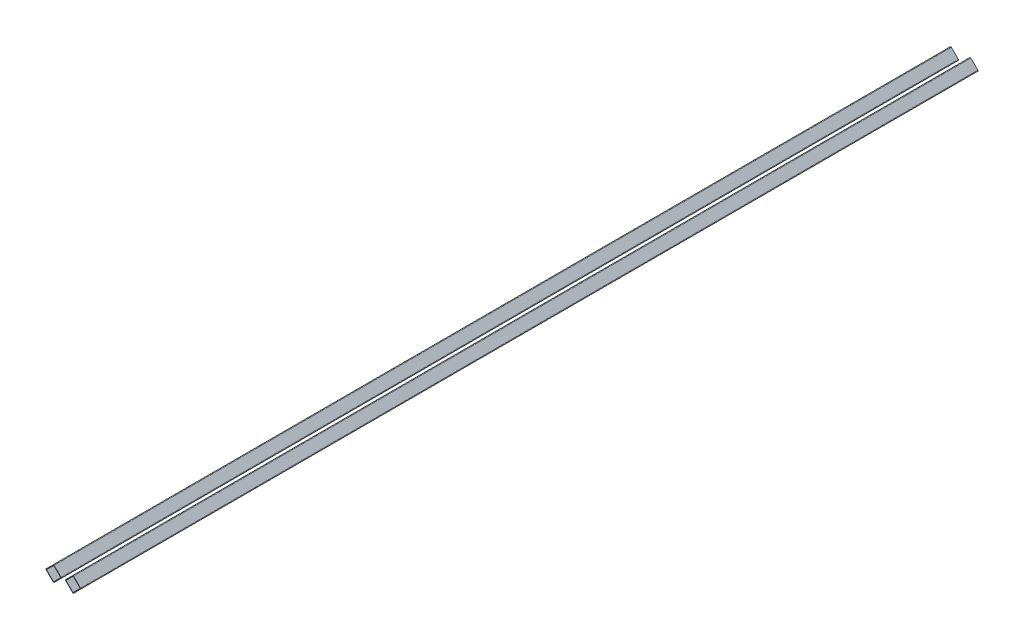
from build123d import *

# Parameters (mm, degrees)
BOSS_EXTRUDE1_DEPTH   = 3048
BOSS_EXTRUDE1_2_DEPTH = 3048


with BuildPart() as part:
    # inch square tube → Boss-Extrude1 (new body)
    with BuildSketch(Plane.XY):
        with BuildLine():
            Line((25.243712088, -1.697056275), (1.697056275, -25.243712088))
            ThreePointArc((1.697056275, -25.243712088), (0, -25.946655814), (-1.697056275, -25.243712088))
            Line((-1.697056275, -25.243712088), (-25.243712088, -1.697056275))
            ThreePointArc((-25.243712088, -1.697056275), (-25.946655814, 0), (-25.243712088, 1.697056275))
            Line((-25.243712088, 1.697056275), (-1.697056275, 25.243712088))
            ThreePointArc((-1.697056275, 25.243712088), (0, 25.946655814), (1.697056275, 25.243712088))
            Line((1.697056275, 25.243712088), (25.243712088, 1.697056275))
            ThreePointArc((25.243712088, 1.697056275), (25.946655814, 0), (25.243712088, -1.697056275))
        make_face()
        with BuildLine():
            Line((-24.112341238, 0.565685425), (-0.565685425, 24.112341238))
            ThreePointArc((-0.565685425, 24.112341238), (0, 24.346655814), (0.565685425, 24.112341238))
            Line((0.565685425, 24.112341238), (24.112341238, 0.565685425))
            ThreePointArc((24.112341238, 0.565685425), (24.346655814, 0), (24.112341238, -0.565685425))
            Line((24.112341238, -0.565685425), (0.565685425, -24.112341238))
            ThreePointArc((0.565685425, -24.112341238), (0, -24.346655814), (-0.565685425, -24.112341238))
            Line((-0.565685425, -24.112341238), (-24.112341238, -0.565685425))
            ThreePointArc((-24.112341238, -0.565685425), (-24.346655814, 0), (-24.112341238, 0.565685425))
        make_face(mode=Mode.SUBTRACT)
    extrude(amount=BOSS_EXTRUDE1_DEPTH)


with BuildPart() as body_2:
    # inch square tube → Boss-Extrude1 2 (new body)
    with BuildSketch(Plane.XY):
        with BuildLine():
            Line((-40.866058562, -2.972649224), (-64.412714375, -26.519305038))
            ThreePointArc((-64.412714375, -26.519305038), (-66.10977065, -27.222248763), (-67.806826925, -26.519305038))
            Line((-67.806826925, -26.519305038), (-91.353482739, -2.972649224))
            ThreePointArc((-91.353482739, -2.972649224), (-92.056426464, -1.27559295), (-91.353482739, 0.421463325))
            Line((-91.353482739, 0.421463325), (-67.806826925, 23.968119139))
            ThreePointArc((-67.806826925, 23.968119139), (-66.10977065, 24.671062864), (-64.412714375, 23.968119139))
            Line((-64.412714375, 23.968119139), (-40.866058562, 0.421463325))
            ThreePointArc((-40.866058562, 0.421463325), (-40.163114837, -1.27559295), (-40.866058562, -2.972649224))
        make_face()
        with BuildLine():
            Line((-90.222111889, -0.709907525), (-66.675456075, 22.836748289))
            ThreePointArc((-66.675456075, 22.836748289), (-66.10977065, 23.071062864), (-65.544085225, 22.836748289))
            Line((-65.544085225, 22.836748289), (-41.997429412, -0.709907525))
            ThreePointArc((-41.997429412, -0.709907525), (-41.763114837, -1.27559295), (-41.997429412, -1.841278375))
            Line((-41.997429412, -1.841278375), (-65.544085225, -25.387934188))
            ThreePointArc((-65.544085225, -25.387934188), (-66.10977065, -25.622248763), (-66.675456075, -25.387934188))
            Line((-66.675456075, -25.387934188), (-90.222111889, -1.841278375))
            ThreePointArc((-90.222111889, -1.841278375), (-90.456426464, -1.27559295), (-90.222111889, -0.709907525))
        make_face(mode=Mode.SUBTRACT)
    extrude(amount=BOSS_EXTRUDE1_2_DEPTH)


solid = Compound([part.part, body_2.part])
